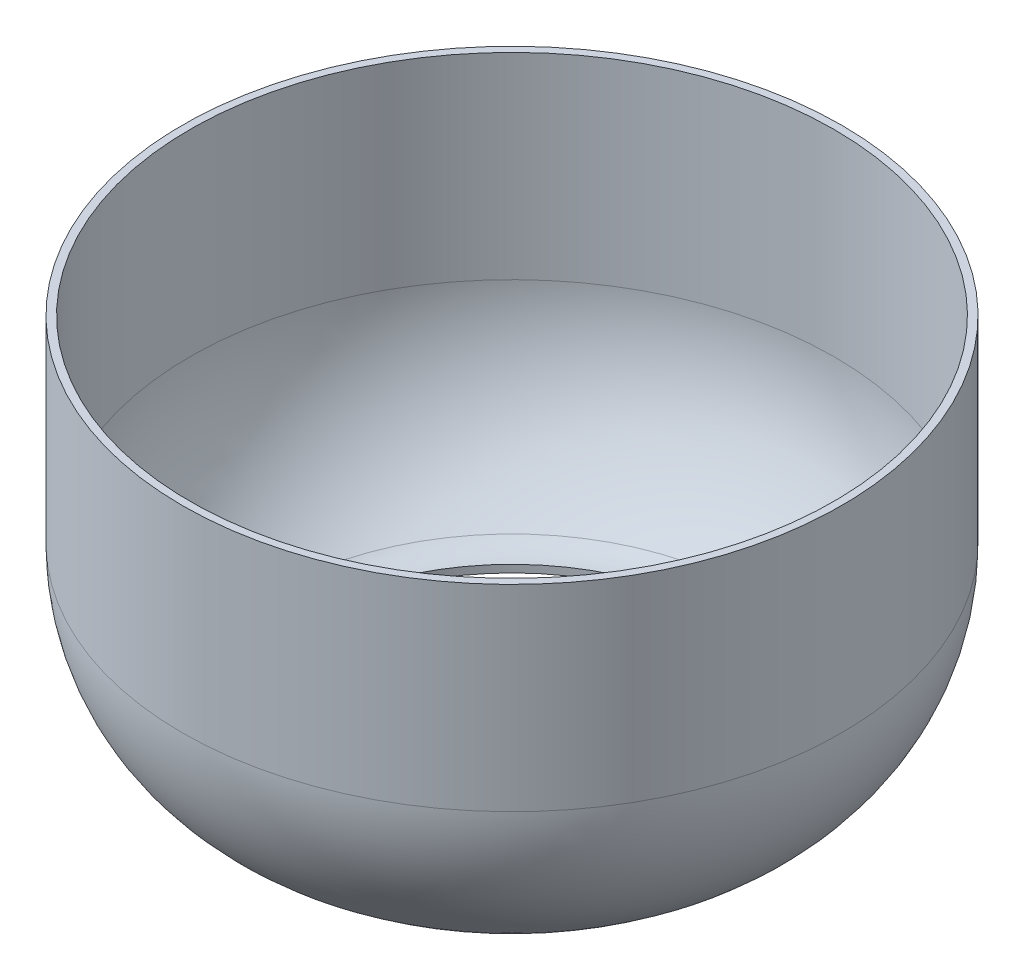
from build123d import *


with BuildPart() as part:
    # Çizim1 → Döndür1 (revolve)
    with BuildSketch(Plane.XY, mode=Mode.PRIVATE) as d_nd_r1_sk:
        with BuildLine():
            Line((-64.5, 0), (-64.5, 39.42))
            Line((-64.5, 39.42), (-66, 39.42))
            Line((-66, 39.42), (-66, 0))
            ThreePointArc((-66, 0), (-61.392201024, -18.85475624), (-48.607542423, -33.459075763))
            ThreePointArc((-48.607542423, -33.459075763), (-45.791233173, -34.917124766), (-42.66, -35.42))
            Line((-42.66, -35.42), (-42.66, -33.92))
            ThreePointArc((-42.66, -33.92), (-45.330140403, -33.489718101), (-47.729948316, -32.242435347))
            ThreePointArc((-47.729948316, -32.242435347), (-60.056829884, -18.171469881), (-64.5, 0))
        make_face()
    revolve(d_nd_r1_sk.sketch.rotate(Axis((0, 0, 0), (0, 1, 0)), 270), axis=Axis((0, 0, 0), (0, 1, 0)))


solid = part.part
